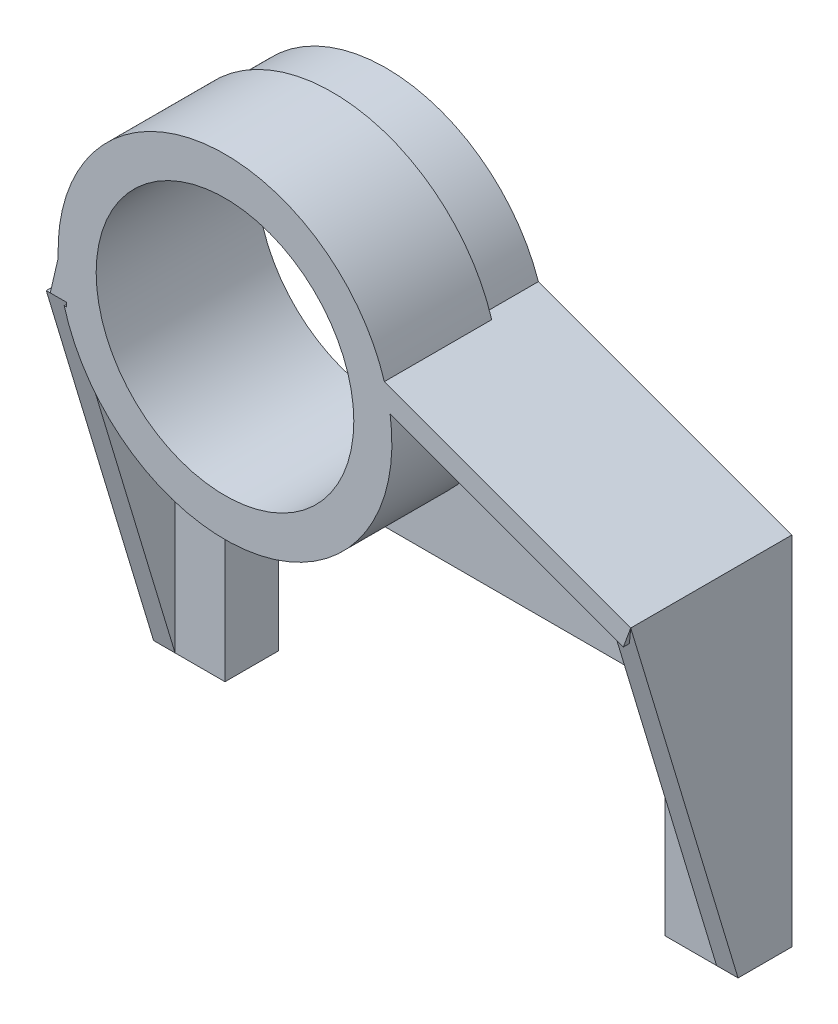
from build123d import *

# Parameters (mm, degrees)
SKETCH1_R           = 12
BOSS_EXTRUDE1_DEPTH = 5
BOSS_EXTRUDE2_DEPTH = 2
BOSS_EXTRUDE3_DEPTH = 2
SKETCH4_R           = 15.547757557
SKETCH4_R_2         = 12
BOSS_EXTRUDE4_DEPTH = 10
SKETCH5_W           = 10
SKETCH5_H           = 9.018962752
BOSS_EXTRUDE5_DEPTH = 2
SKETCH6_W           = 25.14370714
SKETCH6_H           = 10
BOSS_EXTRUDE6_DEPTH = 2
CUT_EXTRUDE1_DEPTH  = 2
CUT_EXTRUDE2_DEPTH  = 0.2


with BuildPart() as part:
    # Sketch1 → Boss-Extrude1 (new body)
    with BuildSketch(Plane.XY):
        with BuildLine():
            Line((-27.15, 21.666502105), (-25.112032094, 30.452193651))
            ThreePointArc((-25.112032094, 30.452193651), (-11.263369735, 42.043284959), (3.691801624, 31.919960581))
            Line((3.691801624, 31.919960581), (27.293258902, 23.278095711))
            Line((27.293258902, 23.278095711), (27.293258902, 10))
            Line((27.293258902, 10), (27.293258902, -9.955183239))
            Line((27.293258902, -9.955183239), (20.497693749, -9.955183239))
            Line((20.497693749, -9.955183239), (20.497693749, 10))
            Line((20.497693749, 10), (-20.5, 10))
            Line((-20.5, 10), (-20.5, -9.955183239))
            Line((-20.5, -9.955183239), (-27.15, -9.955183239))
            Line((-27.15, -9.955183239), (-27.15, 10))
            Line((-27.15, 10), (-27.15, 21.666502105))
        make_face()
        with Locations((-10.5, 27.062721997)):
            Circle(SKETCH1_R, mode=Mode.SUBTRACT)
    extrude(amount=BOSS_EXTRUDE1_DEPTH)

    # Sketch2 → Boss-Extrude2 (add)
    with BuildSketch(Plane(origin=(27.293258902, 0, 0), x_dir=(0, 0, -1), z_dir=(1, 0, 0))):
        Polygon((-5, -9.955183239), (-5, 23.278095711), (-15, 23.278095711), align=None)
    extrude(amount=-BOSS_EXTRUDE2_DEPTH)

    # Sketch3 → Boss-Extrude3 (add)
    with BuildSketch(Plane.ZY.offset(27.15)):
        Polygon((5, -9.955183239), (5, 23.278095711), (15, 23.278095711), align=None)
    extrude(amount=-BOSS_EXTRUDE3_DEPTH)

    # Sketch4 → Boss-Extrude4 (add)
    with BuildSketch(Plane.XY.offset(5)):
        with Locations((-10.5, 27.062721997)):
            Circle(SKETCH4_R)
        with Locations((-10.5, 27.062721997)):
            Circle(SKETCH4_R_2, mode=Mode.SUBTRACT)
    extrude(amount=BOSS_EXTRUDE4_DEPTH)

    # Sketch5 → Boss-Extrude5 (add)
    with BuildSketch(Plane(origin=(-30.532955865, 7.082559615, 0), x_dir=(0, 0, 1), z_dir=(-0.9741354729183627, 0.22596477690586622, 0))):
        with Locations((10, 21.050556457)):
            Rectangle(SKETCH5_W, SKETCH5_H)
    extrude(amount=-BOSS_EXTRUDE5_DEPTH)

    # Sketch6 → Boss-Extrude6 (add)
    with BuildSketch(Plane(origin=(10.742458336, 29.338305481, 0), x_dir=(0.9390305732894374, -0.34383365517021547, 0), z_dir=(0.34383365517021547, 0.9390305732894374, 0))):
        with Locations((5.053558251, -10)):
            Rectangle(SKETCH6_W, SKETCH6_H)
    extrude(amount=-BOSS_EXTRUDE6_DEPTH)

    # Sketch7 → Cut-Extrude1 (cut, along a direction that is not the sketch's normal)
    with BuildSketch(Plane(origin=(3.73770034, 16.113247996, 0), x_dir=(0.9741354729183627, -0.22596477690586628, -2.8423494966508805e-14), z_dir=(-0.2259647769058663, -0.9741354729183628, -1.225338527992233e-13))):
        Polygon((-29.99078277, 15), (-31.343644404, 15), (-31.343644404, 14.975239248), (-29.99078277, 14.883253417), align=None)
    extrude(amount=-CUT_EXTRUDE1_DEPTH, dir=(2.329279663418559e-14, -0.9575879123587351, -0.2881412676178814), mode=Mode.SUBTRACT)

    # Sketch8 → Cut-Extrude2 (cut)
    with BuildSketch(Plane.ZY.offset(25.477385016)):
        Polygon((15, 22.890108534), (15, 23.278095711), (14.883253417, 22.890108534), align=None)
    extrude(amount=-CUT_EXTRUDE2_DEPTH, mode=Mode.SUBTRACT)


solid = part.part
